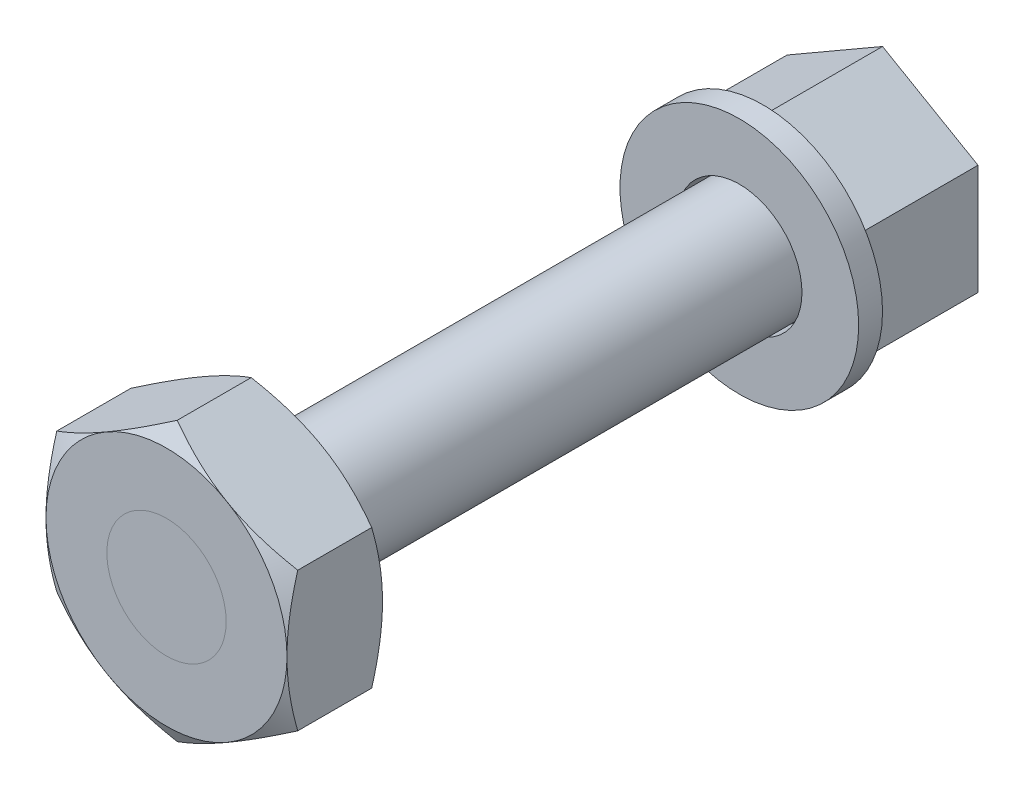
from build123d import *

# Parameters (mm, degrees)
SKETCH1_R           = 5
BOSS_EXTRUDE1_DEPTH = 10
BOSS_EXTRUDE2_START = 10
SKETCH1_3_R         = 5
BOSS_EXTRUDE2_DEPTH = 50
BOSS_EXTRUDE3_START = 10
SKETCH3_R           = 10
SKETCH3_R_2         = 5.25
BOSS_EXTRUDE3_DEPTH = 2
SKETCH4_R           = 5
BOSS_EXTRUDE4_DEPTH = 8


with BuildPart() as part:
    # Sketch1 → Boss-Extrude1 (new body)
    # profile 1 of 2: a face of its own
    with BuildSketch(Plane.XY):
        Polygon((-11.163210479, -1.701501358), (-3.163210479, 2.917300796), (-3.163210479, 12.154905103), (-11.163210479, 16.773707256), (-19.163210479, 12.154905103), (-19.163210479, 2.917300796), align=None)
        with Locations((-11.163210479, 7.536102949)):
            Circle(SKETCH1_R, mode=Mode.SUBTRACT)
    # profile 2 of 2: a face of its own
    with BuildSketch(Plane.XY):
        with Locations((-11.163210479, 7.536102949)):
            Circle(SKETCH1_R)
    extrude(amount=BOSS_EXTRUDE1_DEPTH)

    # Sketch1<3> → Boss-Extrude2 (add)
    with BuildSketch(Plane.XY.offset(BOSS_EXTRUDE2_START)):
        with Locations((-11.163210479, 7.536102949)):
            Circle(SKETCH1_3_R)
    extrude(amount=BOSS_EXTRUDE2_DEPTH)


with BuildPart() as body_2:
    # Sketch3 → Boss-Extrude3 (new body)
    with BuildSketch(Plane.XY.offset(BOSS_EXTRUDE3_START)):
        with Locations((-11.163210479, 7.536102949)):
            Circle(SKETCH3_R)
        with Locations((-11.163210479, 7.536102949)):
            Circle(SKETCH3_R_2, mode=Mode.SUBTRACT)
    extrude(amount=BOSS_EXTRUDE3_DEPTH)


with BuildPart() as body_3:
    # Sketch4 → Boss-Extrude4 (new body)
    with BuildSketch(Plane.XY.offset(60)):
        Polygon((-11.163210479, -4.123618998), (-1.065595071, 1.706241975), (-1.065595071, 13.365963923), (-11.163210479, 19.195824897), (-21.260825886, 13.365963923), (-21.260825886, 1.706241975), align=None)
        with Locations((-11.163210479, 7.536102949)):
            Circle(SKETCH4_R, mode=Mode.SUBTRACT)
    extrude(amount=-BOSS_EXTRUDE4_DEPTH)

    # Sketch5 → Cut-Revolve1 (revolve, cut)
    with BuildSketch(Plane(origin=(0, 7.536102949, 0), x_dir=(-1, 0, 0), z_dir=(0, -1, 0))):
        Polygon((28.189029116, -56), (14.332622656, -64), (14.332622656, -68.5), (39.332622656, -68.5), (39.332622656, -43.5), (14.332622656, -43.5), (14.332622656, -48), align=None)
    revolve(axis=Axis((-11.163210479, 7.536102949, 101.6), (0, 0, 1)), mode=Mode.SUBTRACT)


solid = Compound([part.part, body_2.part, body_3.part])
